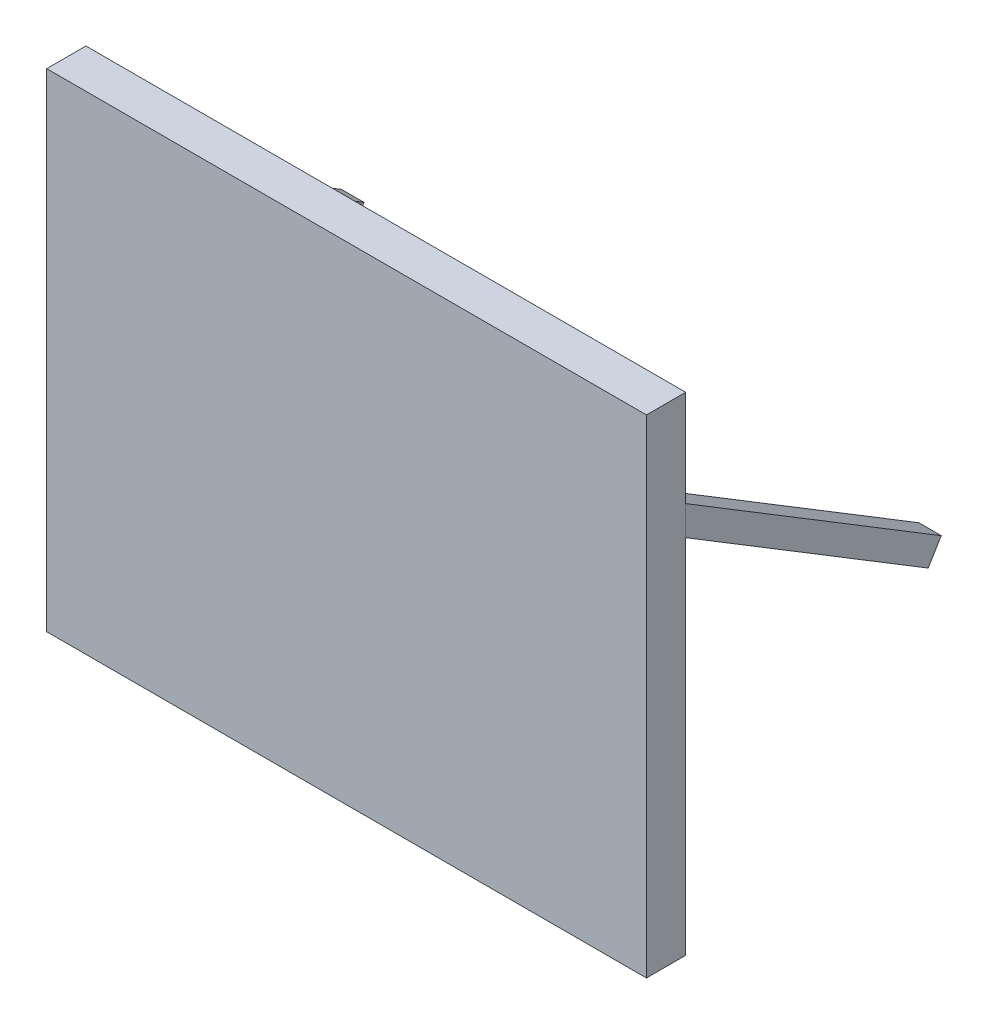
from build123d import *

# Parameters (mm, degrees)
SKETCH1_W           = 679.45
SKETCH1_H           = 552.45
BOSS_EXTRUDE1_DEPTH = 44.45
BOSS_EXTRUDE2_DEPTH = 25.4
BOSS_EXTRUDE3_START = -679.45
BOSS_EXTRUDE3_DEPTH = 25.4


with BuildPart() as part:
    # Sketch1 → Boss-Extrude1 (new body)
    with BuildSketch(Plane.XY):
        Rectangle(SKETCH1_W, SKETCH1_H)
    extrude(amount=BOSS_EXTRUDE1_DEPTH)

    # Sketch2<2> → Boss-Extrude3 (add)
    with BuildSketch(Plane(origin=(339.725, 0, 0), x_dir=(0, 0, -1), z_dir=(1, 0, 0)).offset(BOSS_EXTRUDE3_START)):
        Polygon((0, 166.995205226), (289.566652053, -9.249482666), (274.720053486, -33.642160214), (0, 133.566148273), align=None)
    extrude(amount=BOSS_EXTRUDE3_DEPTH)


with BuildPart() as body_2:
    # Sketch2 → Boss-Extrude2 (new body)
    with BuildSketch(Plane(origin=(339.725, 0, 0), x_dir=(0, 0, -1), z_dir=(1, 0, 0))):
        Polygon((0, 166.995205226), (289.566652053, -9.249482666), (274.720053486, -33.642160214), (0, 133.566148273), align=None)
    extrude(amount=-BOSS_EXTRUDE2_DEPTH)


solid = Compound([part.part, body_2.part])
